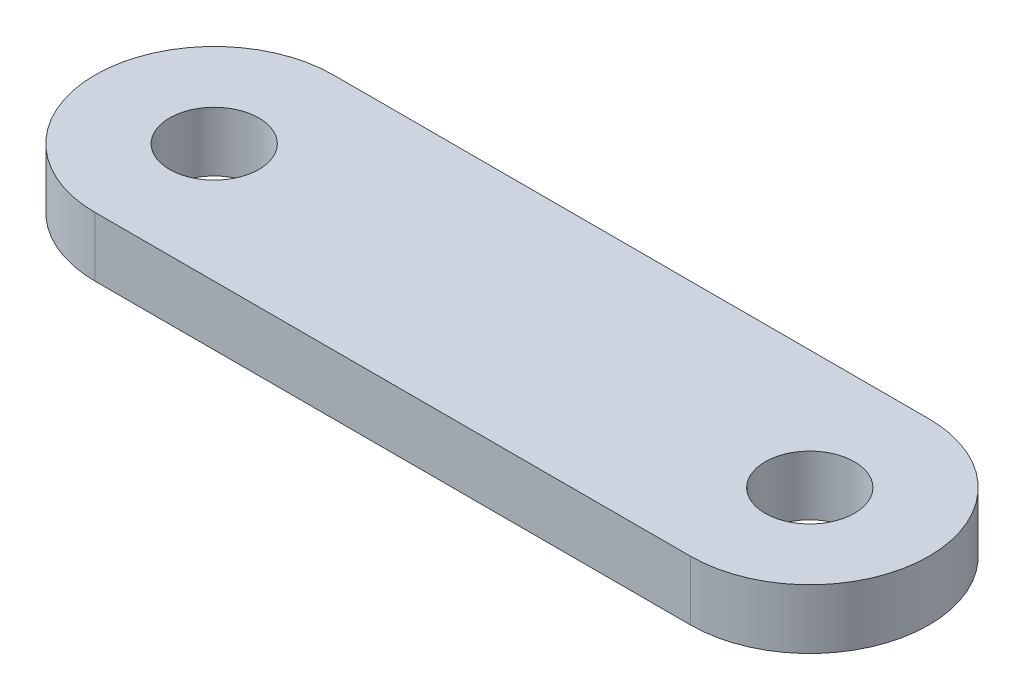
from build123d import *

# Parameters (mm, degrees)
SKETCH1_R           = 1.905
BOSS_EXTRUDE1_DEPTH = 2.54


with BuildPart() as part:
    # Sketch1 → Boss-Extrude1 (new body)
    with BuildSketch(Plane(origin=(0, 0, 0), x_dir=(1, 0, 0), z_dir=(0, 1, 0))):
        with BuildLine():
            Line((-12.7, 5.08), (12.7, 5.08))
            ThreePointArc((12.7, 5.08), (17.78, 0), (12.7, -5.08))
            Line((12.7, -5.08), (-12.7, -5.08))
            ThreePointArc((-12.7, -5.08), (-17.78, 0), (-12.7, 5.08))
        make_face()
        with Locations(Location((-12.7, 0, 0), (0, 0, 270))):
            Circle(SKETCH1_R, mode=Mode.SUBTRACT)
        with Locations(Location((12.7, 0, 0), (0, 0, 270))):
            Circle(SKETCH1_R, mode=Mode.SUBTRACT)
    extrude(amount=BOSS_EXTRUDE1_DEPTH)


solid = part.part
